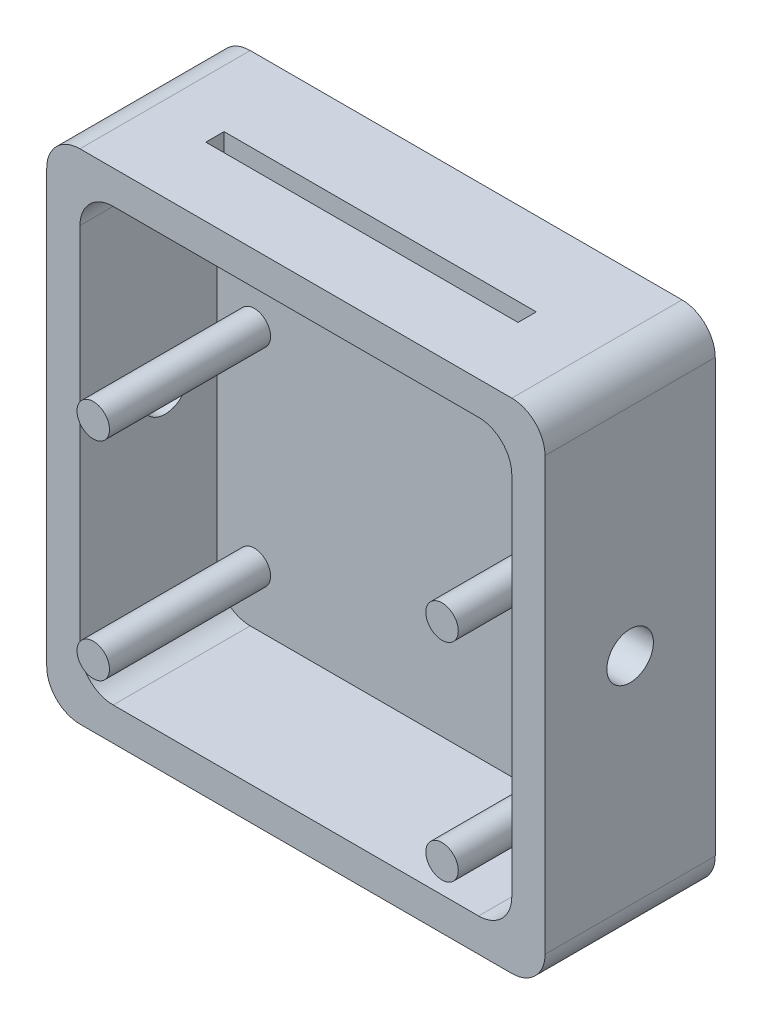
from build123d import *

# Parameters (mm, degrees)
SKETCH1_W           = 30
SKETCH1_H           = 30
BOSS_EXTRUDE1_DEPTH = 2
SKETCH4_R           = 0.9775
BOSS_EXTRUDE3_DEPTH = 9.7
SKETCH5_W           = 30
SKETCH5_H           = 30
SKETCH5_W_2         = 26
SKETCH5_H_2         = 26
BOSS_EXTRUDE4_DEPTH = 8.25
SKETCH6_W           = 18.8
SKETCH6_H           = 1.1
CUT_EXTRUDE1_DEPTH  = 10
FILLET1_R           = 2
CUT_EXTRUDE4_DEPTH  = 0.25
BOSS_EXTRUDE6_DEPTH = 0.05
CUT_EXTRUDE5_DEPTH  = 0.25
BOSS_EXTRUDE7_DEPTH = 0.05
SKETCH23_R          = 1.4
CUT_EXTRUDE6_DEPTH  = 3
CUT_EXTRUDE7_START  = -3
SKETCH24_R          = 1.4
CUT_EXTRUDE7_DEPTH  = 3


with BuildPart() as part:
    # Sketch1 → Boss-Extrude1 (new body)
    with BuildSketch(Plane.XY):
        with Locations((-5.423452769, 0.244299674)):
            Rectangle(SKETCH1_W, SKETCH1_H)
    extrude(amount=BOSS_EXTRUDE1_DEPTH)

    # Sketch4 → Boss-Extrude3 (add)
    with BuildSketch(Plane.XY.offset(2)):
        with Locations((-16.173452769, 2.943299674)):
            Circle(SKETCH4_R)
        with Locations((-16.173452769, -9.555700326)):
            Circle(SKETCH4_R)
        with Locations((4.826547231, 2.943299674)):
            Circle(SKETCH4_R)
        with Locations((4.826547231, -9.555700326)):
            Circle(SKETCH4_R)
    extrude(amount=BOSS_EXTRUDE3_DEPTH)

    # Sketch5 → Boss-Extrude4 (add)
    with BuildSketch(Plane.XY.offset(2)):
        with Locations((-5.423452769, 0.244299674)):
            Rectangle(SKETCH5_W, SKETCH5_H)
        with Locations((-5.423452769, 0.244299674)):
            Rectangle(SKETCH5_W_2, SKETCH5_H_2, mode=Mode.SUBTRACT)
    extrude(amount=BOSS_EXTRUDE4_DEPTH)

    # Sketch6 → Cut-Extrude1 (cut)
    with BuildSketch(Plane(origin=(0, 15.244299674, 0), x_dir=(1, 0, 0), z_dir=(0, 1, 0))):
        with Locations((-5.582175382, -5.564963199)):
            Rectangle(SKETCH6_W, SKETCH6_H)
    extrude(amount=-CUT_EXTRUDE1_DEPTH, mode=Mode.SUBTRACT)

    # Fillet1
    fillet1_edges = [part.edges().sort_by_distance(p)[0] for p in [
        (7.576547231, 13.244299674, 6.125),
        (7.576547231, -12.755700326, 6.125),
        (-18.423452769, -12.755700326, 6.125),
        (-18.423452769, 13.244299674, 6.125),
        (-20.423452769, 15.244299674, 5.125),
        (9.576547231, 15.244299674, 5.125),
        (9.576547231, -14.755700326, 5.125),
        (-20.423452769, -14.755700326, 5.125),
    ]]
    fillet(fillet1_edges, radius=FILLET1_R)

    # Sketch15 → Cut-Extrude4 (cut)
    with BuildSketch(Plane(origin=(0, 0, 0), x_dir=(-1, 0, 0), z_dir=(0, 0, -1))):
        with BuildLine():
            Line((-4.48872314, 13.480732705), (-4.48872314, 10.524770746))
            ThreePointArc((-4.48872314, 10.524770746), (-4.67872314, 10.334770746), (-4.86872314, 10.524770746))
            Line((-4.86872314, 10.524770746), (-4.86872314, 13.480732705))
            ThreePointArc((-4.86872314, 13.480732705), (-4.67872314, 13.670732705), (-4.48872314, 13.480732705))
        make_face()
    extrude(amount=-CUT_EXTRUDE4_DEPTH, mode=Mode.SUBTRACT)

    # Sketch16 → Boss-Extrude6 (add)
    with BuildSketch(Plane(origin=(0, 0, 0), x_dir=(-1, 0, 0), z_dir=(0, 0, -1))):
        with BuildLine():
            Line((-4.86872314, 10.923343064), (-4.772315146, 10.923343064))
            Line((-4.772315146, 10.923343064), (-4.772315146, 13.480732705))
            ThreePointArc((-4.772315146, 13.480732705), (-4.68554888, 13.567498971), (-4.598782614, 13.480732705))
            Line((-4.598782614, 13.480732705), (-4.598782614, 10.923343064))
            Line((-4.598782614, 10.923343064), (-4.48872314, 10.923343064))
            Line((-4.48872314, 10.923343064), (-4.48872314, 13.480732705))
            ThreePointArc((-4.48872314, 13.480732705), (-4.67872314, 13.670732705), (-4.86872314, 13.480732705))
            Line((-4.86872314, 13.480732705), (-4.86872314, 10.923343064))
        make_face()
    extrude(amount=-BOSS_EXTRUDE6_DEPTH)

    # Sketch20 → Cut-Extrude5 (cut)
    with BuildSketch(Plane(origin=(0, 0, 0), x_dir=(-1, 0, 0), z_dir=(0, 0, -1))):
        with BuildLine():
            Line((16.739959819, 13.377498971), (16.739959819, 10.515388846))
            ThreePointArc((16.739959819, 10.515388846), (16.549959819, 10.325388846), (16.359959819, 10.515388846))
            Line((16.359959819, 10.515388846), (16.359959819, 13.377498971))
            ThreePointArc((16.359959819, 13.377498971), (16.549959819, 13.567498971), (16.739959819, 13.377498971))
        make_face()
    extrude(amount=-CUT_EXTRUDE5_DEPTH, mode=Mode.SUBTRACT)

    # Sketch19 → Boss-Extrude7 (add)
    with BuildSketch(Plane(origin=(0, 0, 0), x_dir=(-1, 0, 0), z_dir=(0, 0, -1))):
        with BuildLine():
            Line((16.359959819, 10.82010933), (16.456367814, 10.82010933))
            Line((16.456367814, 10.82010933), (16.456367814, 13.377498971))
            ThreePointArc((16.456367814, 13.377498971), (16.543134079, 13.464265237), (16.629900345, 13.377498971))
            Line((16.629900345, 13.377498971), (16.629900345, 10.82010933))
            Line((16.629900345, 10.82010933), (16.739959819, 10.82010933))
            Line((16.739959819, 10.82010933), (16.739959819, 13.377498971))
            ThreePointArc((16.739959819, 13.377498971), (16.549959819, 13.567498971), (16.359959819, 13.377498971))
            Line((16.359959819, 13.377498971), (16.359959819, 10.82010933))
        make_face()
    extrude(amount=-BOSS_EXTRUDE7_DEPTH)

    # Sketch23 → Cut-Extrude6 (cut)
    with BuildSketch(Plane.ZY.offset(20.423452769)):
        with Locations((5.125, 0.244299674)):
            Circle(SKETCH23_R)
    extrude(amount=-CUT_EXTRUDE6_DEPTH, mode=Mode.SUBTRACT)

    # Sketch24 → Cut-Extrude7 (cut)
    with BuildSketch(Plane(origin=(9.576547231, 0, 0), x_dir=(0, 0, -1), z_dir=(1, 0, 0)).offset(CUT_EXTRUDE7_START)):
        with Locations(Location((-5.125, 0.244299674, 0), (0, 0, 180))):
            Circle(SKETCH24_R)
    extrude(amount=CUT_EXTRUDE7_DEPTH, mode=Mode.SUBTRACT)


solid = part.part
